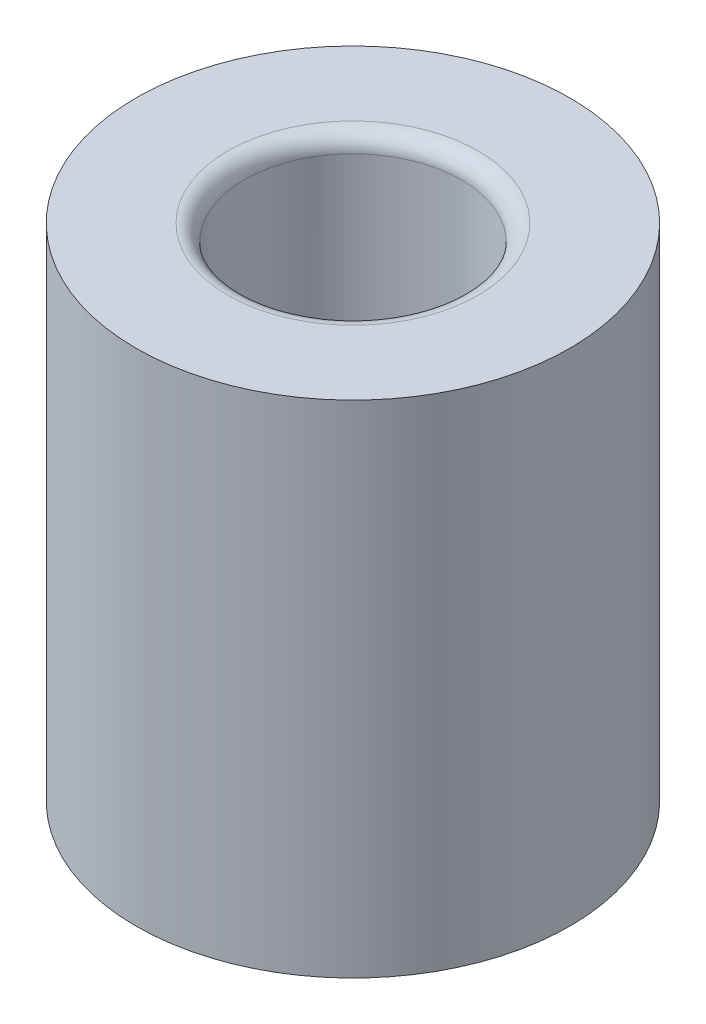
from build123d import *

# Parameters (mm, degrees)
ESBO_O1_R                = 6.5
RESSALTO_EXTRUS_O1_DEPTH = 15
ESBO_O4_R                = 4.5
CORTE_EXTRUS_O1_DEPTH    = 3.1
ESBO_O5_R                = 3.25
CORTE_EXTRUS_O2_DEPTH    = 16.036954479
CHANFRO1_SIZE            = 0.5
FILETE1_R                = 0.5
FILETE2_R                = 0.5


with BuildPart() as part:
    # Esboço1 → Ressalto-extrusão1 (new body)
    with BuildSketch(Plane(origin=(0, 0, 0), x_dir=(1, 0, 0), z_dir=(0, 1, 0))):
        with Locations(Location((0, 0, 0), (0, 0, 270))):
            Circle(ESBO_O1_R)
    extrude(amount=RESSALTO_EXTRUS_O1_DEPTH)

    # Esboço4 → Corte-extrusão1 (cut)
    with BuildSketch(Plane.XZ):
        with Locations(Location((0, 0, 0), (0, 0, 270))):
            Circle(ESBO_O4_R)
    extrude(amount=-CORTE_EXTRUS_O1_DEPTH, mode=Mode.SUBTRACT)

    # Esboço5 → Corte-extrusão2 (cut, through all)
    with BuildSketch(Plane.XZ.offset(-3.1)):
        with Locations(Location((0, 0, 0), (0, 0, 270))):
            Circle(ESBO_O5_R)
    extrude(amount=-CORTE_EXTRUS_O2_DEPTH, mode=Mode.SUBTRACT)

    # Chanfro1
    chanfro1_edges = [part.edges().sort_by_distance(p)[0] for p in [
        (0, 0, 4.5),
    ]]
    chamfer(chanfro1_edges, length=CHANFRO1_SIZE)

    # Filete1
    filete1_edges = [part.edges().sort_by_distance(p)[0] for p in [
        (0, 3.1, 3.25),
    ]]
    fillet(filete1_edges, radius=FILETE1_R)

    # Filete2
    filete2_edges = [part.edges().sort_by_distance(p)[0] for p in [
        (0, 15, 3.25),
    ]]
    fillet(filete2_edges, radius=FILETE2_R)


solid = part.part
